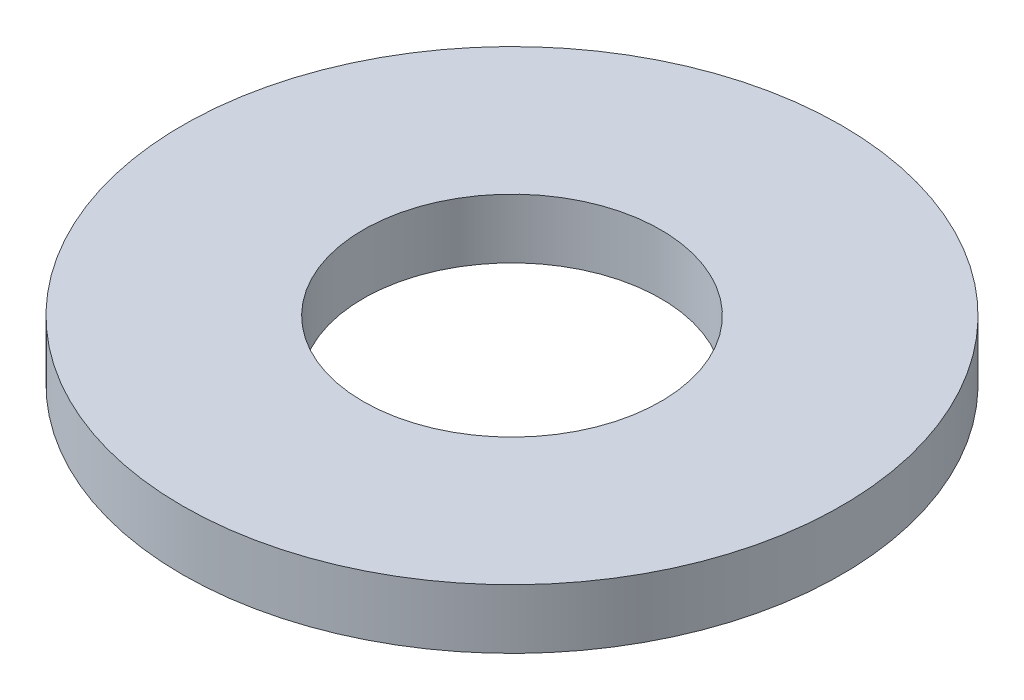
from build123d import *

# Parameters (mm, degrees)
SKETCH1_R           = 11.075
SKETCH1_R_2         = 5
BOSS_EXTRUDE1_DEPTH = 2


with BuildPart() as part:
    # Sketch1 → Boss-Extrude1 (new body)
    with BuildSketch(Plane(origin=(0, 0, 0), x_dir=(1, 0, 0), z_dir=(0, 1, 0))):
        with Locations(Location((0, 0, 0), (0, 0, 270))):
            Circle(SKETCH1_R)
        with Locations(Location((0, 0, 0), (0, 0, 270))):
            Circle(SKETCH1_R_2, mode=Mode.SUBTRACT)
    extrude(amount=BOSS_EXTRUDE1_DEPTH)


solid = part.part
